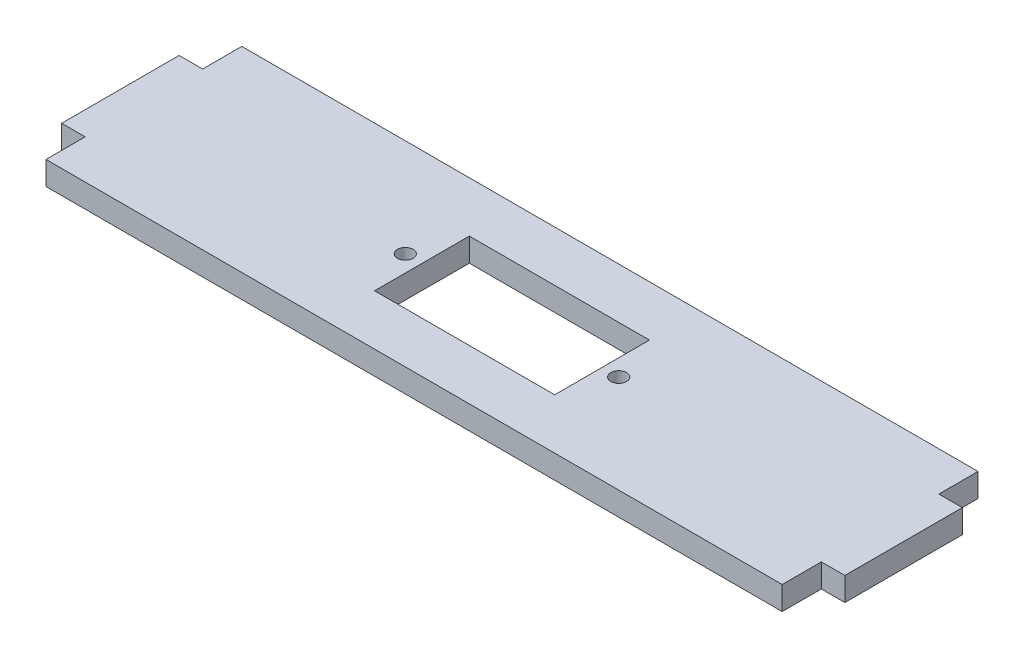
from build123d import *

# Parameters (mm, degrees)
BOSS_EXTRUDE1_DEPTH = 3
SKETCH2_R           = 1
SKETCH2_W           = 23
SKETCH2_H           = 12.1
CUT_EXTRUDE1_DEPTH  = 23.3


with BuildPart() as part:
    # Sketch1 → Boss-Extrude1 (new body)
    with BuildSketch(Plane(origin=(0, 0, 0), x_dir=(1, 0, 0), z_dir=(0, 1, 0))):
        Polygon((47, -7.5), (50, -7.5), (50, 7.5), (47, 7.5), (47, 12.5), (-47, 12.5), (-47, 7.5), (-50, 7.5), (-50, -7.5), (-47, -7.5), (-47, -12.5), (47, -12.5), align=None)
    extrude(amount=BOSS_EXTRUDE1_DEPTH)

    # Sketch2 → Cut-Extrude1 (cut)
    with BuildSketch(Plane(origin=(0, 3, 0), x_dir=(1, 0, 0), z_dir=(0, 1, 0))):
        with Locations(Location((-13.625, 0, 0), (0, 0, 270))):
            Circle(SKETCH2_R)
        with Locations(Location((13.625, 0, 0), (0, 0, 270))):
            Circle(SKETCH2_R)
        Rectangle(SKETCH2_W, SKETCH2_H)
    extrude(amount=-CUT_EXTRUDE1_DEPTH, mode=Mode.SUBTRACT)


solid = part.part
